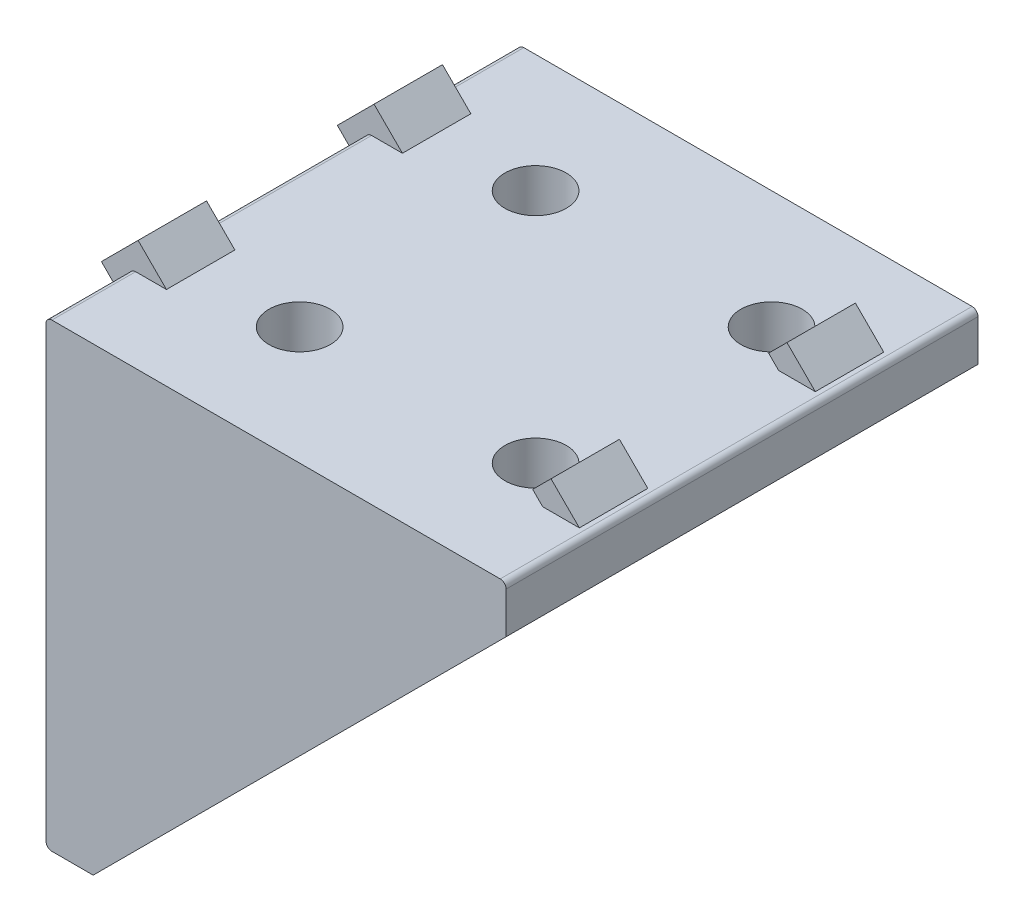
from build123d import *

# Parameters (mm, degrees)
EXTRUDE_1_DEPTH     = 20
EXTRUDE_2_DEPTH     = 4
SKETCH_3_R          = 2.6
CUT_EXTRUDE_1_DEPTH = 54.38539126
SKETCH_4_R          = 2.6
CUT_EXTRUDE_2_DEPTH = 54.38539126
EXTRUDE_START       = -10
EXTRUDE_3_DEPTH     = 2.9
FILLET_1_R          = 0.5
CHAMFER_1_SIZE      = 1


with BuildPart() as part:
    # Эскиз1 → Бобышка-Вытянуть1 (new, symmetric)
    with BuildSketch(Plane.XY):
        Polygon((0, 0), (0, -35), (-4, -35), (-4, 4), (35, 4), (35, 0), align=None)
    extrude(amount=EXTRUDE_1_DEPTH, both=True)

    # Эскиз2 → Бобышка-Вытянуть2 (add)
    with BuildSketch(Plane.XY.offset(20)):
        Polygon((0, -35), (0, 0), (35, 0), align=None)
    extrude_2 = extrude(amount=-EXTRUDE_2_DEPTH)

    # Зеркальное отражение1: Бобышка-Вытянуть2 across plane
    add(extrude_2.mirror(Plane.XY))

    # Эскиз3 → Вырез-Вытянуть1 (cut, through all)
    with BuildSketch(Plane(origin=(0, 0, 0), x_dir=(0, 0, -1), z_dir=(1, 0, 0))):
        with Locations((-10, -27.5)):
            Circle(SKETCH_3_R)
        with Locations((10, -27.5)):
            Circle(SKETCH_3_R)
        with Locations((10, -7.5)):
            Circle(SKETCH_3_R)
        with Locations((-10, -7.5)):
            Circle(SKETCH_3_R)
    extrude(amount=-CUT_EXTRUDE_1_DEPTH, mode=Mode.SUBTRACT)

    # Эскиз4 → Вырез-Вытянуть2 (cut, through all)
    with BuildSketch(Plane.XZ):
        with Locations((27.5, -10)):
            Circle(SKETCH_4_R)
        with Locations((7.5, -10)):
            Circle(SKETCH_4_R)
        with Locations((7.5, 10)):
            Circle(SKETCH_4_R)
        with Locations((27.5, 10)):
            Circle(SKETCH_4_R)
    extrude(amount=-CUT_EXTRUDE_2_DEPTH, mode=Mode.SUBTRACT)

    # Эскиз5 → Бобышка-Вытянуть3 (add, symmetric)
    with BuildSketch(Plane.XY.offset(20).offset(EXTRUDE_START)):
        Polygon((-0.888730163, 4), (-3.292893219, 6.404163056), (-6.404163056, 3.292893219), (-4, 0.888730163), (-4, 4), align=None)
        Polygon((35, 3.111269837), (31.707106781, 6.404163056), (30.151471863, 4.848528137), (35, 0), align=None)
        Polygon((-4.848528137, -30.151471863), (0, -35), (-3.111269837, -35), (-6.404163056, -31.707106781), align=None)
    extrude_3 = extrude(amount=EXTRUDE_3_DEPTH, both=True)

    # Зеркальное отражение2: Бобышка-Вытянуть3 across plane
    add(extrude_3.mirror(Plane.XY))

    # Скругление1
    fillet_1_edges = [part.edges().sort_by_distance(p)[0] for p in [
        (-4, -35, 0),
        (-4, 4, 16.45),
        (35, 4, 0),
        (-4, 4, -16.45),
        (-4, 4, 0),
    ]]
    fillet(fillet_1_edges, radius=FILLET_1_R)

    # Фаска1
    chamfer_1_edges = [part.edges().sort_by_distance(p)[0] for p in [
        (0, 0, 0),
        (0, -17.5, 16),
        (17.5, 0, 16),
        (17.5, 0, -16),
        (0, -17.5, -16),
    ]]
    chamfer(chamfer_1_edges, length=CHAMFER_1_SIZE)


solid = part.part
